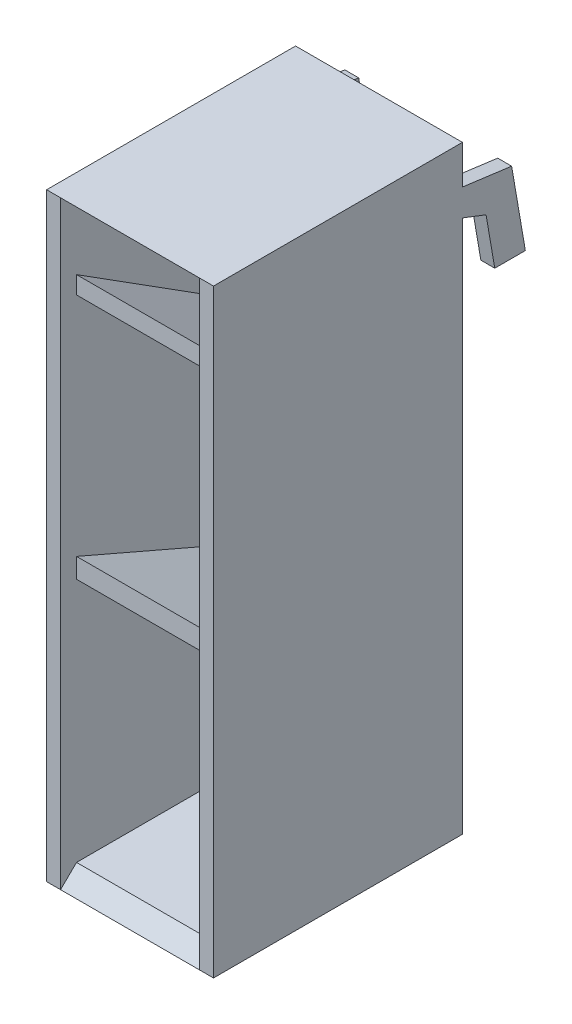
from build123d import *

# Parameters (mm, degrees)
BOSS_EXTRUDE1_DEPTH = 10
BOSS_EXTRUDE2_DEPTH = 2


with BuildPart() as part:
    # Sketch1 → Boss-Extrude1 (new body)
    with BuildSketch(Plane(origin=(0, 0, 0), x_dir=(0, 0, -1), z_dir=(1, 0, 0))):
        Polygon((-3.774433469, 9.358035215), (-35.757790758, 29.614700037), (-35.757790758, 27.080766413), (-3.774433469, 7.792183966), (-3.774433469, -19.326020697), (-35.757790758, -5.486543586), (-35.757790758, -8.33500588), (-3.774433469, -21.674922387), (-3.774433469, -43.604639285), (-35.757790758, -43.604639285), (-38.060598591, -45.851882357), (-2.255261006, -45.851882357), (-2.255261006, 40.341171907), (-38.060598591, 40.341171907), (-35.757790758, 39.035588244), (-3.774433469, 39.035588244), align=None)
    boss_extrude1 = extrude(amount=BOSS_EXTRUDE1_DEPTH)

    # Sketch1<4> → Boss-Extrude2 (add)
    with BuildSketch(Plane(origin=(0, 0, 0), x_dir=(0, 0, -1), z_dir=(1, 0, 0))):
        Polygon((-38.060598591, 40.341171907), (-38.060598591, -45.851882357), (-2.255261006, -45.851882357), (-2.255261006, 30.924278392), (1.146733549, 29.614700037), (2.396539842, 22.331937706), (6.798273933, 22.331937706), (4.824416605, 33.833827141), (-2.255261006, 34.77223015), (-2.255261006, 40.341171907), align=None)
    boss_extrude2 = extrude(amount=-BOSS_EXTRUDE2_DEPTH)

    # Mirror1: Boss-Extrude1, Boss-Extrude2 across plane
    add(boss_extrude1.mirror(Plane(origin=(10, 0, 0), x_dir=(0, 0, 1), z_dir=(1, 0, 0))))
    add(boss_extrude2.mirror(Plane(origin=(10, 0, 0), x_dir=(0, 0, 1), z_dir=(1, 0, 0))))


solid = part.part
